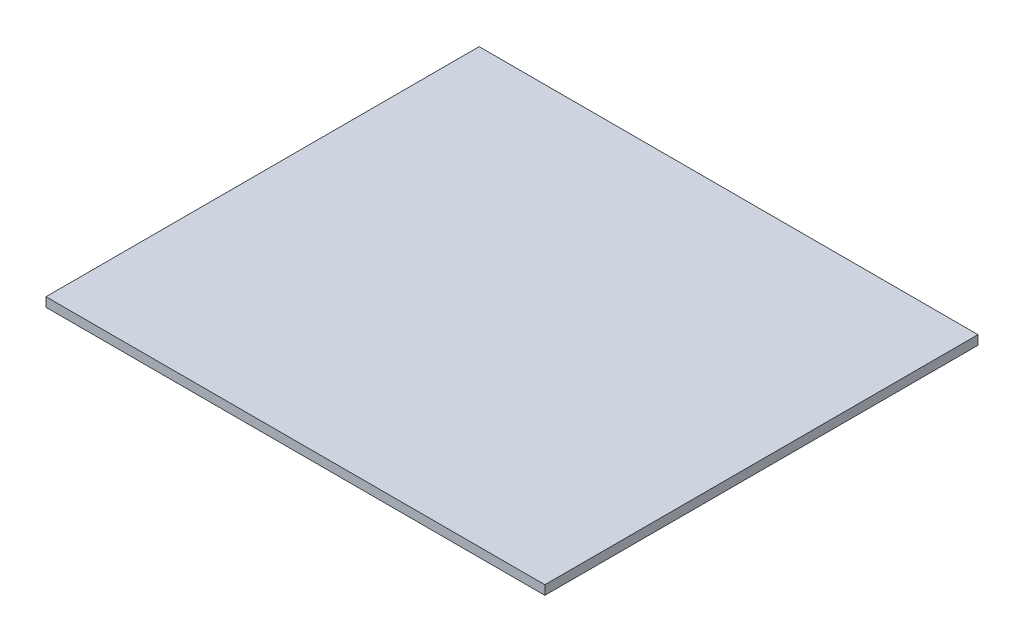
from build123d import *

# Parameters (mm, degrees)
SKETCH1_W           = 1031.748
SKETCH1_H           = 895.858
BOSS_EXTRUDE1_DEPTH = 19.05


with BuildPart() as part:
    # Sketch1 → Boss-Extrude1 (new body)
    with BuildSketch(Plane(origin=(0, 0, 0), x_dir=(1, 0, 0), z_dir=(0, 1, 0))):
        Rectangle(SKETCH1_W, SKETCH1_H)
    extrude(amount=BOSS_EXTRUDE1_DEPTH)


solid = part.part
